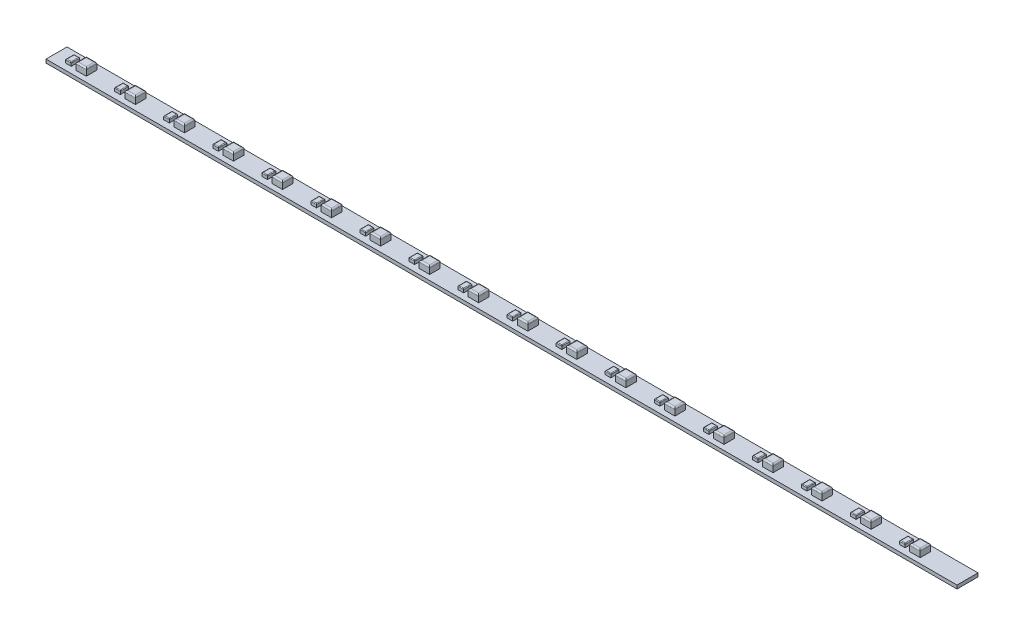
from build123d import *

# Parameters (mm, degrees)
SKETCH_1_W                     = 130
SKETCH_1_H                     = 3
EXTRUDE_1_DEPTH                = 0.5
SKETCH_2_W                     = 1.5
SKETCH_2_H                     = 1.5
EXTRUDE_2_DEPTH                = 1
SKETCH_3_W                     = 0.8
SKETCH_3_H                     = 1.2
EXTRUDE_3_DEPTH                = 0.5
FILLET_1_R                     = 0.2
FILLET_2_R                     = 0.1
PATTERN_LINEAR_3_COUNT         = 18
PATTERN_LINEAR_3_PITCH         = 7
FILLET_1_OF_PATTERN_LINEAR_3_R = 0.2
FILLET_2_OF_PATTERN_LINEAR_3_R = 0.1


with BuildPart() as part:
    # 草图1 → 凸台-拉伸1 (new body)
    with BuildSketch(Plane(origin=(0, 0, 0), x_dir=(1, 0, 0), z_dir=(0, 1, 0))):
        Rectangle(SKETCH_1_W, SKETCH_1_H)
    extrude(amount=EXTRUDE_1_DEPTH)

    # 草图2 → 凸台-拉伸2 (add)
    with BuildSketch(Plane(origin=(0, 0.5, 0), x_dir=(1, 0, 0), z_dir=(0, 1, 0))):
        with Locations((-60.75, 0)):
            Rectangle(SKETCH_2_W, SKETCH_2_H)
    extrude_2 = extrude(amount=EXTRUDE_2_DEPTH)

    # 草图3 → 凸台-拉伸3 (add)
    with BuildSketch(Plane(origin=(0, 0.5, 0), x_dir=(1, 0, 0), z_dir=(0, 1, 0))):
        with Locations((-62.7, 0)):
            Rectangle(SKETCH_3_W, SKETCH_3_H)
    extrude_3 = extrude(amount=EXTRUDE_3_DEPTH)

    # 圆角1
    fillet_1_edges = [part.edges().sort_by_distance(p)[0] for p in [
        (-61.5, 1.5, 0),
        (-60.75, 1.5, 0.75),
        (-60, 1.5, 0),
        (-60.75, 1.5, -0.75),
    ]]
    fillet(fillet_1_edges, radius=FILLET_1_R)

    # 圆角2
    fillet_2_edges = [part.edges().sort_by_distance(p)[0] for p in [
        (-63.1, 1, 0),
        (-62.7, 1, 0.6),
        (-62.3, 1, 0),
        (-62.7, 1, -0.6),
    ]]
    fillet(fillet_2_edges, radius=FILLET_2_R)

    # 阵列(线性)3: 凸台-拉伸2, 凸台-拉伸3 ×18
    with Locations(*[(i * PATTERN_LINEAR_3_PITCH, 0, 0) for i in range(1, PATTERN_LINEAR_3_COUNT)]):
        add(extrude_2)
        add(extrude_3)

    # 圆角1 of 阵列(线性)3
    fillet_1_of_pattern_linear_3_edges = [part.edges().sort_by_distance(p)[0] for p in [
        (-54.5, 1.5, 0),
        (-53.75, 1.5, 0.75),
        (-53, 1.5, 0),
        (-53.75, 1.5, -0.75),
        (-47.5, 1.5, 0),
        (-46.75, 1.5, 0.75),
        (-46, 1.5, 0),
        (-46.75, 1.5, -0.75),
        (-40.5, 1.5, 0),
        (-39.75, 1.5, 0.75),
        (-39, 1.5, 0),
        (-39.75, 1.5, -0.75),
        (-33.5, 1.5, 0),
        (-32.75, 1.5, 0.75),
        (-32, 1.5, 0),
        (-32.75, 1.5, -0.75),
        (-26.5, 1.5, 0),
        (-25.75, 1.5, 0.75),
        (-25, 1.5, 0),
        (-25.75, 1.5, -0.75),
        (-19.5, 1.5, 0),
        (-18.75, 1.5, 0.75),
        (-18, 1.5, 0),
        (-18.75, 1.5, -0.75),
        (-12.5, 1.5, 0),
        (-11.75, 1.5, 0.75),
        (-11, 1.5, 0),
        (-11.75, 1.5, -0.75),
        (-5.5, 1.5, 0),
        (-4.75, 1.5, 0.75),
        (-4, 1.5, 0),
        (-4.75, 1.5, -0.75),
        (1.5, 1.5, 0),
        (2.25, 1.5, 0.75),
        (3, 1.5, 0),
        (2.25, 1.5, -0.75),
        (8.5, 1.5, 0),
        (9.25, 1.5, 0.75),
        (10, 1.5, 0),
        (9.25, 1.5, -0.75),
        (15.5, 1.5, 0),
        (16.25, 1.5, 0.75),
        (17, 1.5, 0),
        (16.25, 1.5, -0.75),
        (22.5, 1.5, 0),
        (23.25, 1.5, 0.75),
        (24, 1.5, 0),
        (23.25, 1.5, -0.75),
        (29.5, 1.5, 0),
        (30.25, 1.5, 0.75),
        (31, 1.5, 0),
        (30.25, 1.5, -0.75),
        (36.5, 1.5, 0),
        (37.25, 1.5, 0.75),
        (38, 1.5, 0),
        (37.25, 1.5, -0.75),
        (43.5, 1.5, 0),
        (44.25, 1.5, 0.75),
        (45, 1.5, 0),
        (44.25, 1.5, -0.75),
        (50.5, 1.5, 0),
        (51.25, 1.5, 0.75),
        (52, 1.5, 0),
        (51.25, 1.5, -0.75),
        (57.5, 1.5, 0),
        (58.25, 1.5, 0.75),
        (59, 1.5, 0),
        (58.25, 1.5, -0.75),
    ]]
    fillet(fillet_1_of_pattern_linear_3_edges, radius=FILLET_1_OF_PATTERN_LINEAR_3_R)

    # 圆角2 of 阵列(线性)3
    fillet_2_of_pattern_linear_3_edges = [part.edges().sort_by_distance(p)[0] for p in [
        (-56.1, 1, 0),
        (-55.7, 1, 0.6),
        (-55.3, 1, 0),
        (-55.7, 1, -0.6),
        (-49.1, 1, 0),
        (-48.7, 1, 0.6),
        (-48.3, 1, 0),
        (-48.7, 1, -0.6),
        (-42.1, 1, 0),
        (-41.7, 1, 0.6),
        (-41.3, 1, 0),
        (-41.7, 1, -0.6),
        (-35.1, 1, 0),
        (-34.7, 1, 0.6),
        (-34.3, 1, 0),
        (-34.7, 1, -0.6),
        (-28.1, 1, 0),
        (-27.7, 1, 0.6),
        (-27.3, 1, 0),
        (-27.7, 1, -0.6),
        (-21.1, 1, 0),
        (-20.7, 1, 0.6),
        (-20.3, 1, 0),
        (-20.7, 1, -0.6),
        (-14.1, 1, 0),
        (-13.7, 1, 0.6),
        (-13.3, 1, 0),
        (-13.7, 1, -0.6),
        (-7.1, 1, 0),
        (-6.7, 1, 0.6),
        (-6.3, 1, 0),
        (-6.7, 1, -0.6),
        (-0.1, 1, 0),
        (0.3, 1, 0.6),
        (0.7, 1, 0),
        (0.3, 1, -0.6),
        (6.9, 1, 0),
        (7.3, 1, 0.6),
        (7.7, 1, 0),
        (7.3, 1, -0.6),
        (13.9, 1, 0),
        (14.3, 1, 0.6),
        (14.7, 1, 0),
        (14.3, 1, -0.6),
        (20.9, 1, 0),
        (21.3, 1, 0.6),
        (21.7, 1, 0),
        (21.3, 1, -0.6),
        (27.9, 1, 0),
        (28.3, 1, 0.6),
        (28.7, 1, 0),
        (28.3, 1, -0.6),
        (34.9, 1, 0),
        (35.3, 1, 0.6),
        (35.7, 1, 0),
        (35.3, 1, -0.6),
        (41.9, 1, 0),
        (42.3, 1, 0.6),
        (42.7, 1, 0),
        (42.3, 1, -0.6),
        (48.9, 1, 0),
        (49.3, 1, 0.6),
        (49.7, 1, 0),
        (49.3, 1, -0.6),
        (55.9, 1, 0),
        (56.3, 1, 0.6),
        (56.7, 1, 0),
        (56.3, 1, -0.6),
    ]]
    fillet(fillet_2_of_pattern_linear_3_edges, radius=FILLET_2_OF_PATTERN_LINEAR_3_R)


solid = part.part
